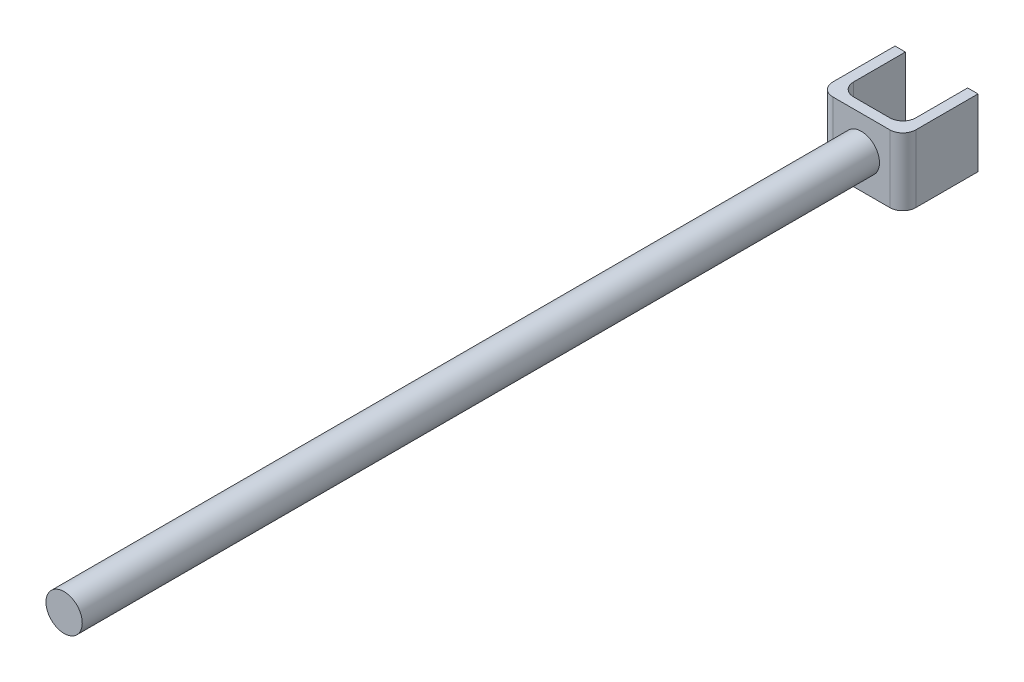
from build123d import *

# Parameters (mm, degrees)
BOSS_EXTRUDE1_DEPTH      = 13
BOSS_EXTRUDE1_DEPTH_BACK = 13
SKETCH2_R                = 7
BOSS_EXTRUDE2_DEPTH      = 307.5


with BuildPart() as part:
    # Sketch1 → Boss-Extrude1 (new, two sides: drawn at the far end of the back side and taken through both)
    with BuildSketch(Plane(origin=(0, 0, 0), x_dir=(1, 0, 0), z_dir=(0, 1, 0)).offset(-BOSS_EXTRUDE1_DEPTH_BACK)):
        with BuildLine():
            Line((7, -20.776256957), (-7, -20.776256957))
            ThreePointArc((-7, -20.776256957), (-10.535533906, -19.311790863), (-12, -15.776256957))
            Line((-12, -15.776256957), (-12, 4.223743043))
            Line((-12, 4.223743043), (-16, 4.223743043))
            Line((-16, 4.223743043), (-16, -19.776256957))
            ThreePointArc((-16, -19.776256957), (-14.535533906, -23.311790863), (-11, -24.776256957))
            Line((-11, -24.776256957), (11, -24.776256957))
            ThreePointArc((11, -24.776256957), (14.535533906, -23.311790863), (16, -19.776256957))
            Line((16, -19.776256957), (16, 4.223743043))
            Line((16, 4.223743043), (12, 4.223743043))
            Line((12, 4.223743043), (12, -15.776256957))
            ThreePointArc((12, -15.776256957), (10.535533906, -19.311790863), (7, -20.776256957))
        make_face()
    extrude(amount=BOSS_EXTRUDE1_DEPTH + BOSS_EXTRUDE1_DEPTH_BACK)

    # Sketch2 → Boss-Extrude2 (add)
    with BuildSketch(Plane.XY.offset(24.776256957)):
        Circle(SKETCH2_R)
    extrude(amount=BOSS_EXTRUDE2_DEPTH)


solid = part.part
